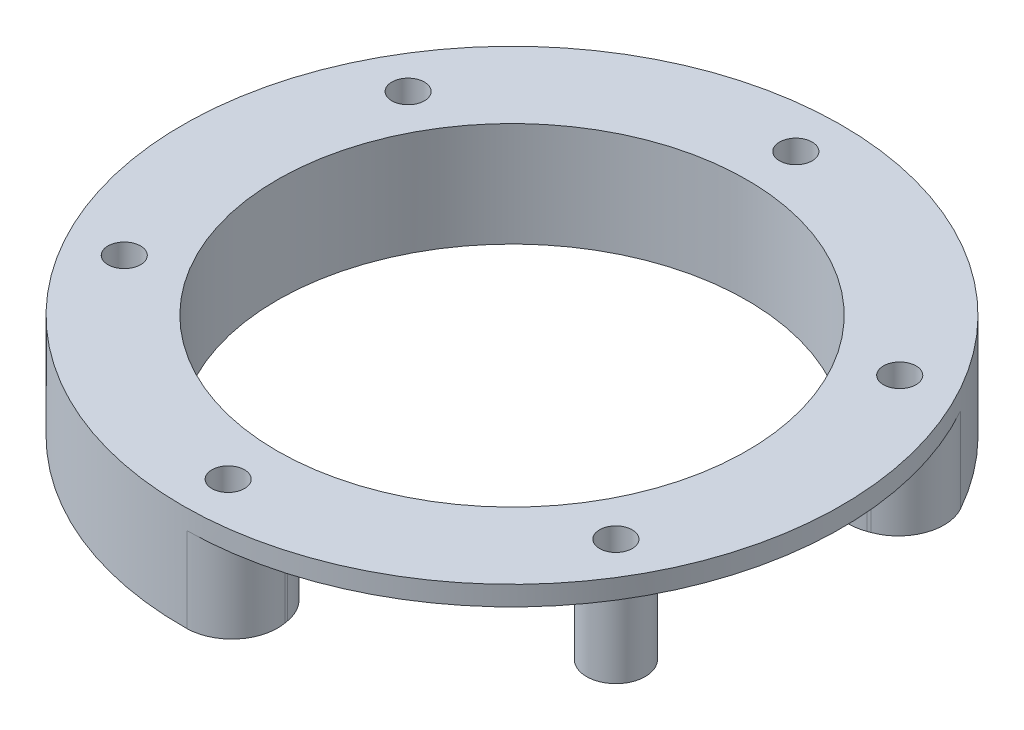
from build123d import *

# Parameters (mm, degrees)
SKETCH1_R           = 50.5
SKETCH1_R_2         = 36
BOSS_EXTRUDE1_DEPTH = 16
SKETCH2_R           = 2.5
CUT_EXTRUDE1_DEPTH  = 74.188113789
SKETCH3_R           = 4.5
CUT_EXTRUDE2_DEPTH  = 13
FILLET1_R           = 7


with BuildPart() as part:
    # Sketch1 → Boss-Extrude1 (new body)
    with BuildSketch(Plane(origin=(0, 0, 0), x_dir=(1, 0, 0), z_dir=(0, 1, 0))):
        with Locations(Location((0, 0, 0), (0, 0, 270))):
            Circle(SKETCH1_R)
        with Locations(Location((0, 0, 0), (0, 0, 270))):
            Circle(SKETCH1_R_2, mode=Mode.SUBTRACT)
    extrude(amount=BOSS_EXTRUDE1_DEPTH)

    # Sketch2 → Cut-Extrude1 (cut, through all)
    with BuildSketch(Plane(origin=(0, 16, 0), x_dir=(1, 0, 0), z_dir=(0, 1, 0))):
        with Locations(Location((0, 43.5, 0), (0, 0, 270))):
            Circle(SKETCH2_R)
        with Locations(Location((37.672105065, 21.75, 0), (0, 0, 270))):
            Circle(SKETCH2_R)
        with Locations(Location((37.672105065, -21.75, 0), (0, 0, 270))):
            Circle(SKETCH2_R)
        with Locations(Location((0, -43.5, 0), (0, 0, 270))):
            Circle(SKETCH2_R)
        with Locations(Location((-37.672105065, -21.75, 0), (0, 0, 270))):
            Circle(SKETCH2_R)
        with Locations(Location((-37.672105065, 21.75, 0), (0, 0, 270))):
            Circle(SKETCH2_R)
    extrude(amount=-CUT_EXTRUDE1_DEPTH, mode=Mode.SUBTRACT)

    # Sketch3 → Cut-Extrude2 (cut)
    with BuildSketch(Plane.XZ):
        with BuildLine():
            Line((0, 0), (8.769232972, 49.732791527))
            ThreePointArc((8.769232972, 49.732791527), (43.734282891, 25.25), (47.45447735, -17.272017238))
            Line((47.45447735, -17.272017238), (0, 0))
        make_face()
        with Locations(Location((37.672105065, 21.75, 0), (0, 0, 270))):
            Circle(SKETCH3_R, mode=Mode.SUBTRACT)
    extrude(amount=-CUT_EXTRUDE2_DEPTH, mode=Mode.SUBTRACT)

    # Fillet1
    fillet1_edges = [part.edges().sort_by_distance(p)[0] for p in [
        (6.251334396, 6.5, 35.453079108),
        (33.828934348, 6.5, -12.31272516),
        (47.45447735, 6.5, -17.272017238),
        (8.769232972, 6.5, 49.732791527),
    ]]
    fillet(fillet1_edges, radius=FILLET1_R)


solid = part.part
